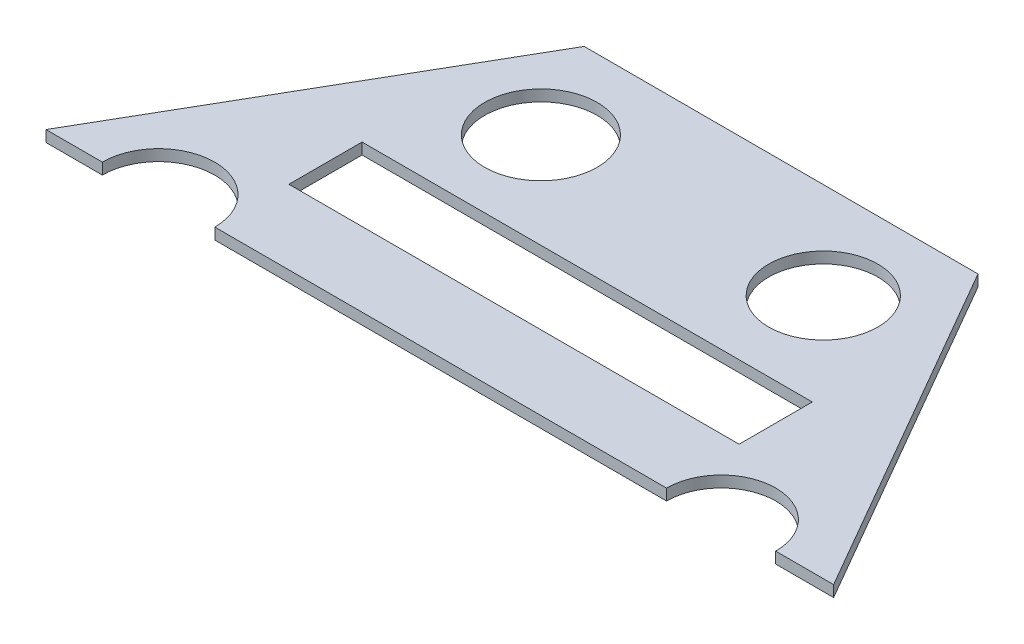
from build123d import *

# Parameters (mm, degrees)
BOSS_EXTRUDE1_DEPTH = 10
SKETCH3_R           = 48.5
SKETCH3_R_2         = 50
SKETCH3_W           = 400
SKETCH3_H           = 65
CUT_EXTRUDE3_DEPTH  = 10
CUT_EXTRUDE4_DEPTH  = 10


with BuildPart() as part:
    # Sketch1 → Boss-Extrude1 (new body)
    with BuildSketch(Plane(origin=(0, 0, 0), x_dir=(1, 0, 0), z_dir=(0, 1, 0))):
        Polygon((175.101753381, 303.050121206), (-174.898226894, 303.167627278), (-349.999980275, 0.117506072), (-175.101753381, -303.050121206), (174.898226894, -303.167627278), (349.999980275, -0.117506072), align=None)
    extrude(amount=BOSS_EXTRUDE1_DEPTH)

    # Sketch3 → Cut-Extrude3 (cut)
    with BuildSketch(Plane(origin=(0, 10, 0), x_dir=(1, 0, 0), z_dir=(0, 1, 0))):
        with Locations(Location((249.999980275, 0, 0), (0, 0, 270))):
            Circle(SKETCH3_R)
        with Locations(Location((-250.000009417, 0.041161845, 0), (0, 0, 270))):
            Circle(SKETCH3_R_2)
        with Locations(Location((-126.076603066, 215.895357646, 0), (0, 0, 270))):
            Circle(SKETCH3_R_2)
        with Locations(Location((122.996764387, 217.697498973, 0), (0, 0, 270))):
            Circle(SKETCH3_R)
        with Locations((0, 98.413699872)):
            Rectangle(SKETCH3_W, SKETCH3_H)
    extrude(amount=-CUT_EXTRUDE3_DEPTH, mode=Mode.SUBTRACT)

    # Sketch2 → Cut-Extrude4 (cut)
    with BuildSketch(Plane(origin=(0, 10, 0), x_dir=(1, 0, 0), z_dir=(0, 1, 0))):
        Polygon((-175.101753381, -303.050121206), (174.898226894, -303.167627278), (349.999980275, -0.117506072), (-349.999980275, 0.117506072), align=None)
    extrude(amount=-CUT_EXTRUDE4_DEPTH, mode=Mode.SUBTRACT)


solid = part.part
